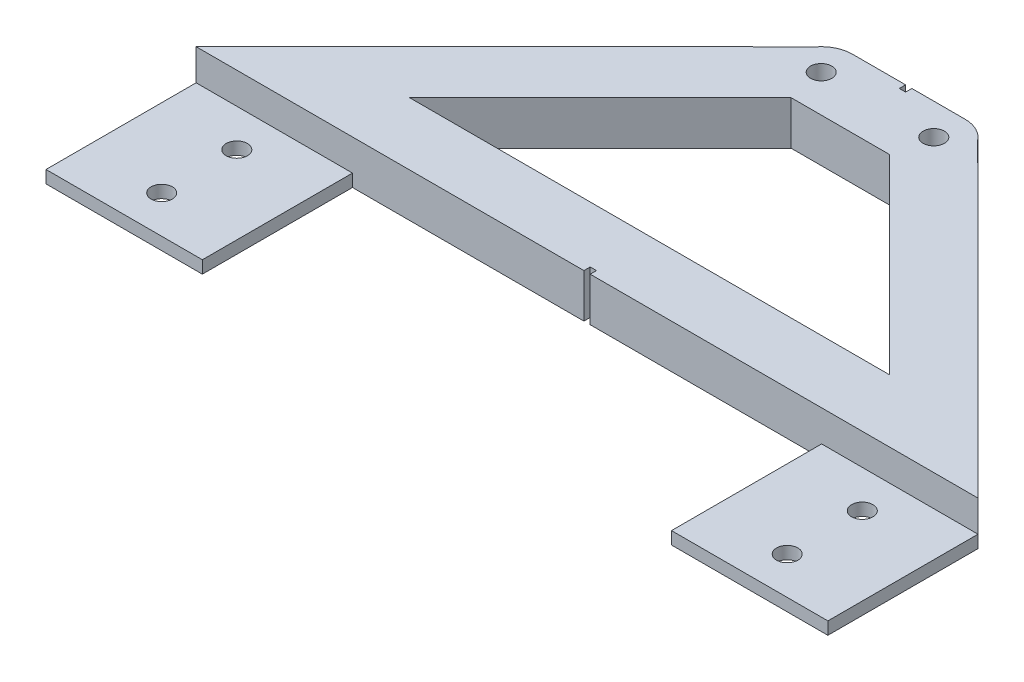
from build123d import *

# Parameters (mm, degrees)
BEARING_MOUNTS_W             = 25
BEARING_MOUNTS_H             = 24
BEARING_MOUNT_PLATES_DEPTH   = 2
BEARING_MOUNT_PLATES_2_DEPTH = 2
BRIDGE_DEPTH                 = 7
M3_BEARING_HOLES_R           = 1.7
BEARING_MOUNT_HOLES_DEPTH    = 2
BELT_MOUNT_PLATE_DEPTH       = 7
M3_BELT_HOLES_R              = 1.7
BELT_MOUNT_SCREW_HOLES_DEPTH = 7
BOSS_EXTRUDE1_DEPTH          = 7
SKETCH7_W                    = 1
SKETCH7_H                    = 7
ALIGNMENT_HELPER_1_DEPTH     = 1
SKETCH8_W                    = 1
SKETCH8_H                    = 7
ALIGNMENT_HELPER_2_DEPTH     = 1


with BuildPart() as part:
    # Bearing Mounts → Bearing Mount Plates (new body)
    with BuildSketch(Plane(origin=(0, 0, 0), x_dir=(1, 0, 0), z_dir=(0, 1, 0))):
        with Locations((12.5, -12)):
            Rectangle(BEARING_MOUNTS_W, BEARING_MOUNTS_H)
    extrude(amount=BEARING_MOUNT_PLATES_DEPTH)


with BuildPart() as body_2:
    # Bearing Mounts → Bearing Mount Plates 2 (new body)
    with BuildSketch(Plane(origin=(0, 0, 0), x_dir=(1, 0, 0), z_dir=(0, 1, 0))):
        with Locations((112.5, -12)):
            Rectangle(BEARING_MOUNTS_W, BEARING_MOUNTS_H)
    extrude(amount=BEARING_MOUNT_PLATES_2_DEPTH)


with BuildPart() as body_3:
    # Triangle → Bridge (new body)
    with BuildSketch(Plane(origin=(0, 0, 0), x_dir=(1, 0, 0), z_dir=(0, 1, 0))):
        Polygon((0, 0), (125, 0), (82.5, 42.5), (42.5, 42.5), align=None)
        Polygon((24.142135624, 10), (100.857864376, 10), (70.357864376, 40.5), (54.642135624, 40.5), align=None, mode=Mode.SUBTRACT)
    extrude(amount=BRIDGE_DEPTH)

    # Belt Mount → Belt Mount Plate (add)
    with BuildSketch(Plane.XZ):
        with BuildLine():
            Line((53.5, -41.428932188), (71.5, -41.428932188))
            ThreePointArc((71.5, -41.428932188), (76.5, -46.428932188), (71.5, -51.428932188))
            Line((71.5, -51.428932188), (53.5, -51.428932188))
            ThreePointArc((53.5, -51.428932188), (48.5, -46.428932188), (53.5, -41.428932188))
        make_face()
    extrude(amount=-BELT_MOUNT_PLATE_DEPTH)

    # M3 Belt Holes → Belt Mount Screw Holes (cut)
    with BuildSketch(Plane.XZ):
        with Locations(Location((53.5, -46.428932188, 0), (0, 0, 270))):
            Circle(M3_BELT_HOLES_R)
        with Locations(Location((71.5, -46.428932188, 0), (0, 0, 270))):
            Circle(M3_BELT_HOLES_R)
    extrude(amount=-BELT_MOUNT_SCREW_HOLES_DEPTH, mode=Mode.SUBTRACT)

    # Sketch6 → Boss-Extrude1 (add)
    with BuildSketch(Plane.XZ):
        Polygon((42.5, -42.5), (49.5, -49.428932188), (50.407510411, -42.5), align=None)
        Polygon((82.5, -42.5), (75.5, -49.428932188), (74.592489589, -42.5), align=None)
    extrude(amount=-BOSS_EXTRUDE1_DEPTH)

    # Sketch7 → Alignment helper 1 (cut)
    with BuildSketch(Plane.XY):
        with Locations((62.5, 3.5)):
            Rectangle(SKETCH7_W, SKETCH7_H)
    extrude(amount=-ALIGNMENT_HELPER_1_DEPTH, mode=Mode.SUBTRACT)

    # Sketch8 → Alignment helper 2 (cut)
    with BuildSketch(Plane(origin=(0, 0, -51.428932188), x_dir=(-1, 0, 0), z_dir=(0, 0, -1))):
        with Locations((-62.5, 3.5)):
            Rectangle(SKETCH8_W, SKETCH8_H)
    extrude(amount=-ALIGNMENT_HELPER_2_DEPTH, mode=Mode.SUBTRACT)


with BuildPart() as bearing_mount_holes_tool:
    # M3 Bearing Holes → Bearing Mount Holes (new body)
    with BuildSketch(Plane.XZ):
        with Locations(Location((112.5, 6, 0), (0, 0, 270))):
            Circle(M3_BEARING_HOLES_R)
        with Locations(Location((112.5, 18, 0), (0, 0, 270))):
            Circle(M3_BEARING_HOLES_R)
        with Locations(Location((12.5, 6, 0), (0, 0, 270))):
            Circle(M3_BEARING_HOLES_R)
        with Locations(Location((12.5, 18, 0), (0, 0, 270))):
            Circle(M3_BEARING_HOLES_R)
    extrude(amount=-BEARING_MOUNT_HOLES_DEPTH)


with BuildPart() as part_1:
    add(part.part)

    # Bearing Mount Holes: cut by bearing_mount_holes_tool
    add(bearing_mount_holes_tool.part, mode=Mode.SUBTRACT)


with BuildPart() as body_2_1:
    add(body_2.part)

    # Bearing Mount Holes: cut by bearing_mount_holes_tool
    add(bearing_mount_holes_tool.part, mode=Mode.SUBTRACT)


solid = Compound([body_3.part, part_1.part, body_2_1.part])
